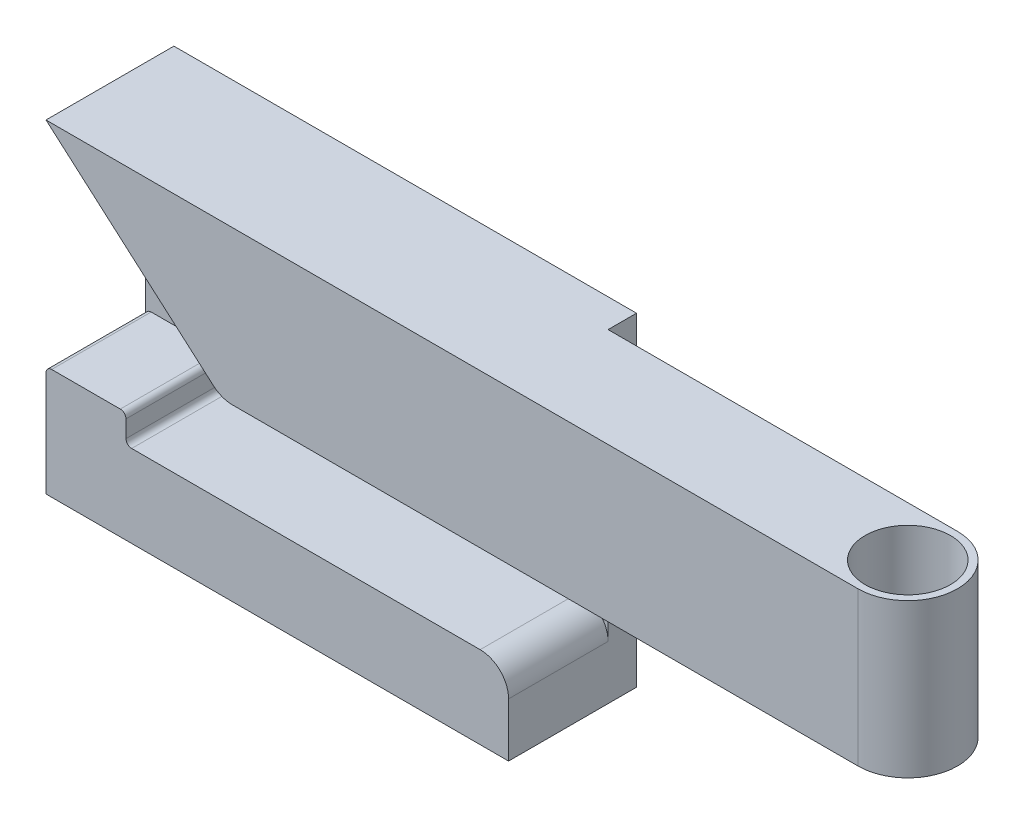
from build123d import *

# Parameters (mm, degrees)
BOSS_EXTRUDE1_DEPTH   = 35
BOSS_EXTRUDE1_2_DEPTH = 35
SKETCH2_W             = 162.732130767
SKETCH2_H             = 113.961013526
BOSS_EXTRUDE2_DEPTH   = 10
SKETCH3_R             = 17.5
BOSS_EXTRUDE3_DEPTH   = 54.006142336
CUT_EXTRUDE2_REACH    = 327.764
SKETCH4_R             = 15
FILLET1_R             = 2
FILLET2_R             = 10


with BuildPart() as part:
    # Sketch1 → Boss-Extrude1 (new body)
    with BuildSketch(Plane.XY):
        Polygon((285.66695455, 30.421117945), (61.771160065, 30.421117945), (0, 84.427260281), (285.66695455, 84.427260281), align=None)
    extrude(amount=BOSS_EXTRUDE1_DEPTH)



with BuildPart() as body_2:
    # Sketch1 → Boss-Extrude1 2 (new body)
    with BuildSketch(Plane.XY):
        Polygon((28.135943206, -0.578882055), (162.732130767, -0.578882055), (162.732130767, -29.533753245), (0, -29.533753245), (0, 0), (0, 9.421117945), (28.135943206, 9.421117945), align=None)
    extrude(amount=BOSS_EXTRUDE1_2_DEPTH)


with BuildPart() as part_1:
    add(part.part)

    add(body_2.part)  # Boss-Extrude2 merges body 2
    # Sketch2 → Boss-Extrude2 (add)
    with BuildSketch(Plane(origin=(0, 0, 0), x_dir=(-1, 0, 0), z_dir=(0, 0, -1))):
        with Locations((-81.366065384, 27.446753518)):
            Rectangle(SKETCH2_W, SKETCH2_H)
    extrude(amount=BOSS_EXTRUDE2_DEPTH)

    # Sketch3 → Boss-Extrude3 (add)
    with BuildSketch(Plane(origin=(0, 84.427260281, 0), x_dir=(1, 0, 0), z_dir=(0, 1, 0))):
        with Locations((285.66695455, -17.5)):
            Circle(SKETCH3_R)
    extrude(amount=-BOSS_EXTRUDE3_DEPTH)

    # Sketch4 → Cut-Extrude2 (cut, up to next)
    with BuildSketch(Plane(origin=(0, 84.427260281, 0), x_dir=(1, 0, 0), z_dir=(0, 1, 0)), mode=Mode.PRIVATE) as cut_extrude2_sk1:
        with Locations(Location((285.66695455, -17.5, 0), (0, 0, 270))):
            Circle(SKETCH4_R)
    cut_extrude2_tool1 = extrude(cut_extrude2_sk1.sketch, amount=-CUT_EXTRUDE2_REACH, mode=Mode.PRIVATE) & part_1.part
    add(cut_extrude2_tool1.solids().sort_by_distance((285.666955, 84.42726, 17.5))[0], mode=Mode.SUBTRACT)

    # Fillet1
    fillet1_edges = [part_1.edges().sort_by_distance(p)[0] for p in [
        (0, 9.421117945, 17.5),
        (28.135943206, 9.421117945, 17.5),
        (28.135943206, -0.578882055, 17.5),
    ]]
    fillet(fillet1_edges, radius=FILLET1_R)

    # Fillet2
    fillet2_edges = [part_1.edges().sort_by_distance(p)[0] for p in [
        (162.732130767, -0.578882055, 17.5),
        (61.771160065, 30.421117945, 17.5),
    ]]
    fillet(fillet2_edges, radius=FILLET2_R)


solid = part_1.part
